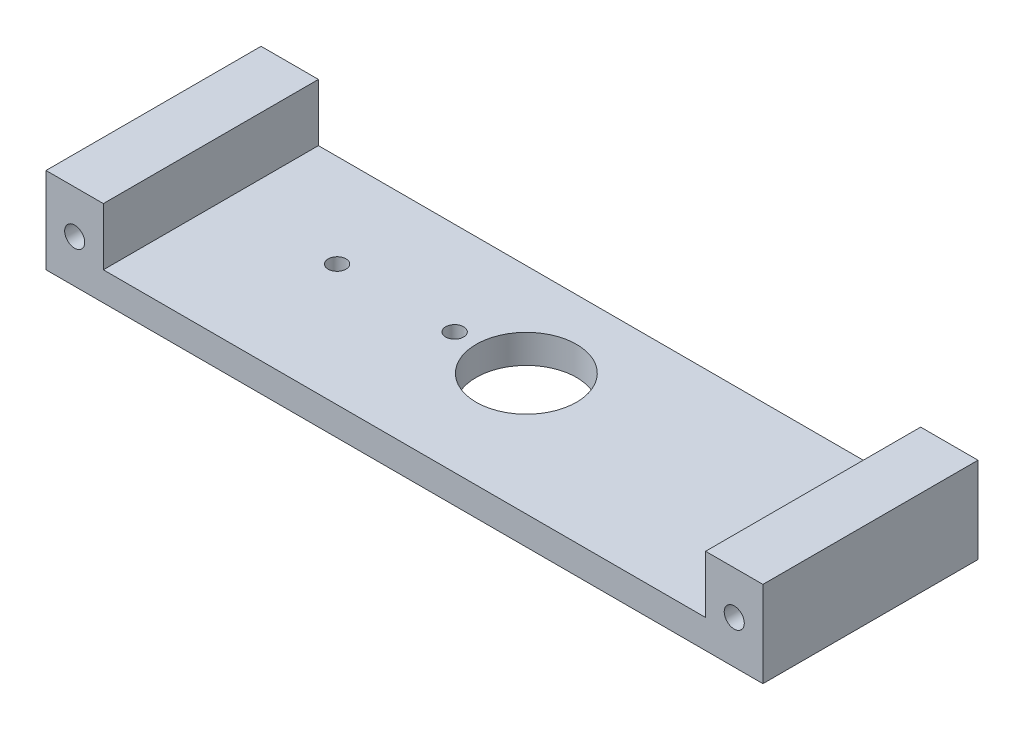
from build123d import *

# Parameters (mm, degrees)
SKETCH1_W                = 50
SKETCH1_H                = 15
BOSS_EXTRUDE1_DEPTH      = 2
SKETCH2_R                = 3.5
CUT_EXTRUDE1_DEPTH       = 2
SKETCH3_W                = 4
SKETCH3_H                = 15
BOSS_EXTRUDE2_DEPTH      = 4
SKETCH4_R                = 0.7
CUT_EXTRUDE2_DEPTH       = 67.866379361
M1_6X0_35_TAPPED_HOLE2_D = 1.25
M1_6X0_35_TAPPED_HOLE1_D = 1.25


with BuildPart() as part:
    # Sketch1 → Boss-Extrude1 (new body)
    with BuildSketch(Plane(origin=(0, 0, 0), x_dir=(1, 0, 0), z_dir=(0, 1, 0))):
        with Locations((-39.885381165, 7.155172414)):
            Rectangle(SKETCH1_W, SKETCH1_H)
    extrude(amount=BOSS_EXTRUDE1_DEPTH)

    # Sketch2 → Cut-Extrude1 (cut)
    with BuildSketch(Plane(origin=(0, 2, 0), x_dir=(1, 0, 0), z_dir=(0, 1, 0))):
        with Locations(Location((-39.885381165, 8.155172414, 0), (0, 0, 270))):
            Circle(SKETCH2_R)
    extrude(amount=-CUT_EXTRUDE1_DEPTH, mode=Mode.SUBTRACT)

    # Sketch3 → Boss-Extrude2 (add)
    with BuildSketch(Plane(origin=(0, 2, 0), x_dir=(1, 0, 0), z_dir=(0, 1, 0))):
        with Locations((-62.885381165, 7.155172414)):
            Rectangle(SKETCH3_W, SKETCH3_H)
        with Locations((-16.885381165, 7.155172414)):
            Rectangle(SKETCH3_W, SKETCH3_H)
    extrude(amount=BOSS_EXTRUDE2_DEPTH)

    # Sketch4 → Cut-Extrude2 (cut, through all)
    with BuildSketch(Plane(origin=(0, 0, -14.655172414), x_dir=(-1, 0, 0), z_dir=(0, 0, -1))):
        with Locations((62.885381165, 3)):
            Circle(SKETCH4_R)
        with Locations((16.885381165, 3)):
            Circle(SKETCH4_R)
    extrude(amount=-CUT_EXTRUDE2_DEPTH, mode=Mode.SUBTRACT)

    # M1.6x0.35 Tapped Hole2 (through all)
    with Locations(Plane(origin=(0, 2, 0), x_dir=(1, 0, 0), z_dir=(0, 1, 0))):
        with Locations((-44.885381165, 8.155172414)):
            Hole(M1_6X0_35_TAPPED_HOLE2_D / 2)

    # M1.6x0.35 Tapped Hole1 (through all)
    with Locations(Plane(origin=(0, 2, 0), x_dir=(1, 0, 0), z_dir=(0, 1, 0))):
        with Locations((-53.083792801, 8.155172414)):
            Hole(M1_6X0_35_TAPPED_HOLE1_D / 2)


solid = part.part
